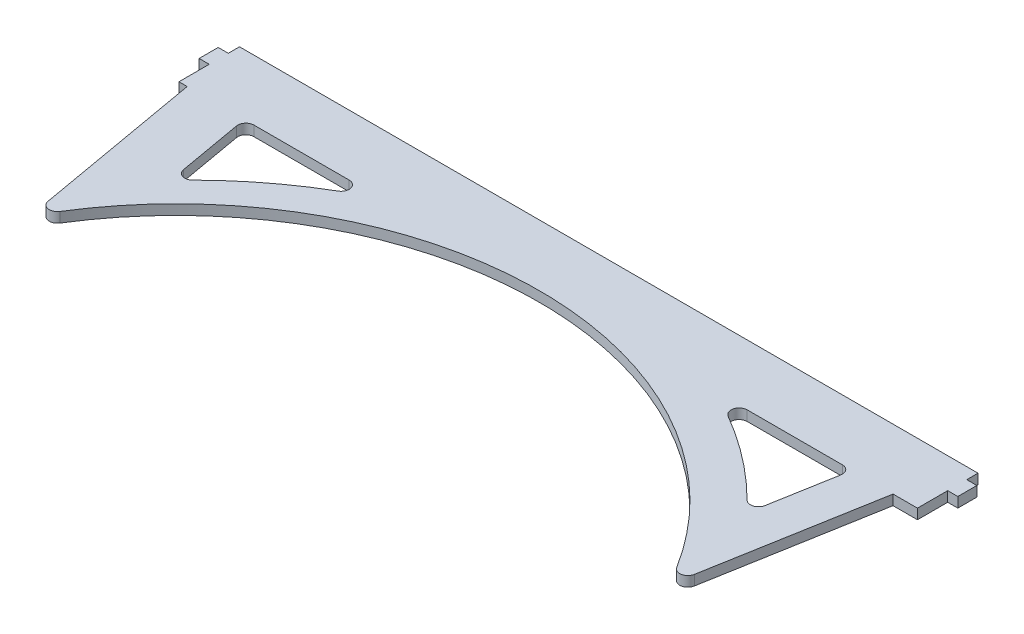
from build123d import *

# Parameters (mm, degrees)
SKETCH1_W               = 666.75
SKETCH1_H               = 19.05
BOSS_EXTRUDE1_DEPTH     = 3.175
SKETCH2_W               = 3.175
SKETCH2_H               = 9.525
CUT_EXTRUDE2_DEPTH      = 334.526156208
TOP_BALL_SECURING_DEPTH = 3.175
FILLET2_R               = 2.54
CUT_EXTRUDE3_DEPTH      = 340.618903378
CUT_EXTRUDE8_REACH      = 341.619
SKETCH12_W              = 214.0585
SKETCH12_H              = 19.05
CUT_EXTRUDE9_REACH      = 137.789
SKETCH13_W              = 3.175
SKETCH13_H              = 3.53251897


with BuildPart() as part:
    # Sketch1 → Boss-Extrude1 (new body)
    with BuildSketch(Plane(origin=(0, 0, 0), x_dir=(1, 0, 0), z_dir=(0, 1, 0))):
        Rectangle(SKETCH1_W, SKETCH1_H)
    extrude(amount=BOSS_EXTRUDE1_DEPTH)

    # Sketch2 → Cut-Extrude2 (cut, through all)
    with BuildSketch(Plane.XZ):
        with Locations((-331.7875, 4.7625)):
            Rectangle(SKETCH2_W, SKETCH2_H)
        with Locations((-117.729, 4.7625)):
            Rectangle(SKETCH2_W, SKETCH2_H)
    cut_extrude2 = extrude(amount=-CUT_EXTRUDE2_DEPTH, mode=Mode.SUBTRACT)

    # Mirror1: Cut-Extrude2 across plane
    add(cut_extrude2.mirror(Plane(origin=(0, 0, 0), x_dir=(0, 0, 1), z_dir=(1, 0, 0))), mode=Mode.SUBTRACT)

    # Sketch3 → top ball securing (add)
    with BuildSketch(Plane(origin=(0, 3.175, 0), x_dir=(1, 0, 0), z_dir=(0, 1, 0))):
        with BuildLine():
            Line((108.470225533, -9.525), (97.899375359, -69.475270408))
            ThreePointArc((97.899375359, -69.475270408), (-2.54, -9.731863753), (-102.979375359, -69.475270408))
            Line((-102.979375359, -69.475270408), (-113.550225533, -9.525))
            Line((-113.550225533, -9.525), (108.470225533, -9.525))
        make_face()
    extrude(amount=-TOP_BALL_SECURING_DEPTH)

    # Fillet2
    fillet2_edges = [part.edges().sort_by_distance(p)[0] for p in [
        (-102.979375359, 1.5875, 69.475270408),
        (97.899375359, 1.5875, 69.475270408),
    ]]
    fillet(fillet2_edges, radius=FILLET2_R)

    # Sketch5 → Cut-Extrude3 (cut, through all)
    with BuildSketch(Plane(origin=(0, 3.175, 0), x_dir=(1, 0, 0), z_dir=(0, 1, 0))):
        with BuildLine():
            Line((-91.472594393, -32.786971326), (-95.048665129, -12.506066371))
            ThreePointArc((-95.048665129, -12.506066371), (-94.493006322, -10.432319471), (-92.547253437, -9.525))
            Line((-92.547253437, -9.525), (-62.60624334, -9.525))
            ThreePointArc((-62.60624334, -9.525), (-60.153898656, -11.403482389), (-61.32886602, -14.260428701))
            ThreePointArc((-61.32886602, -14.260428701), (-74.893704079, -23.368953639), (-87.176845785, -34.143668852))
            ThreePointArc((-87.176845785, -34.143668852), (-89.736130888, -34.767981392), (-91.472594393, -32.786971326))
        make_face()
        with BuildLine():
            Line((92.547253437, -9.525), (62.60624334, -9.525))
            ThreePointArc((62.60624334, -9.525), (60.153898656, -11.403482389), (61.32886602, -14.260428701))
            ThreePointArc((61.32886602, -14.260428701), (74.893704079, -23.368953639), (87.176845785, -34.143668852))
            ThreePointArc((87.176845785, -34.143668852), (89.736130888, -34.767981392), (91.472594393, -32.786971326))
            Line((91.472594393, -32.786971326), (95.048665129, -12.506066371))
            ThreePointArc((95.048665129, -12.506066371), (94.493006322, -10.432319471), (92.547253437, -9.525))
        make_face()
    extrude(amount=-CUT_EXTRUDE3_DEPTH, mode=Mode.SUBTRACT)

    # Sketch12 → Cut-Extrude8 (cut, up to next)
    with BuildSketch(Plane.XZ, mode=Mode.PRIVATE) as cut_extrude8_sk1:
        with Locations((226.34575, 0)):
            Rectangle(SKETCH12_W, SKETCH12_H)
    cut_extrude8_tool1 = extrude(cut_extrude8_sk1.sketch, amount=-CUT_EXTRUDE8_REACH, mode=Mode.PRIVATE) & part.part
    # Sketch12 → Cut-Extrude8 (cut, up to next)
    with BuildSketch(Plane.XZ, mode=Mode.PRIVATE) as cut_extrude8_sk2:
        with Locations((-226.34575, 0)):
            Rectangle(SKETCH12_W, SKETCH12_H)
    cut_extrude8_tool2 = extrude(cut_extrude8_sk2.sketch, amount=-CUT_EXTRUDE8_REACH, mode=Mode.PRIVATE) & part.part
    add(cut_extrude8_tool1.solids().sort_by_distance((226.34575, 0, 0))[0], mode=Mode.SUBTRACT)
    add(cut_extrude8_tool2.solids().sort_by_distance((-226.34575, 0, 0))[0], mode=Mode.SUBTRACT)

    # Sketch13 → Cut-Extrude9 (cut, up to next)
    with BuildSketch(Plane.XZ, mode=Mode.PRIVATE) as cut_extrude9_sk1:
        with Locations((117.729, -7.758740515)):
            Rectangle(SKETCH13_W, SKETCH13_H)
    cut_extrude9_tool1 = extrude(cut_extrude9_sk1.sketch, amount=-CUT_EXTRUDE9_REACH, mode=Mode.PRIVATE) & part.part
    # Sketch13 → Cut-Extrude9 (cut, up to next)
    with BuildSketch(Plane.XZ, mode=Mode.PRIVATE) as cut_extrude9_sk2:
        with Locations((-117.729, -7.758740515)):
            Rectangle(SKETCH13_W, SKETCH13_H)
    cut_extrude9_tool2 = extrude(cut_extrude9_sk2.sketch, amount=-CUT_EXTRUDE9_REACH, mode=Mode.PRIVATE) & part.part
    add(cut_extrude9_tool1.solids().sort_by_distance((117.729, 0, -7.758741))[0], mode=Mode.SUBTRACT)
    add(cut_extrude9_tool2.solids().sort_by_distance((-117.729, 0, -7.758741))[0], mode=Mode.SUBTRACT)


solid = part.part
